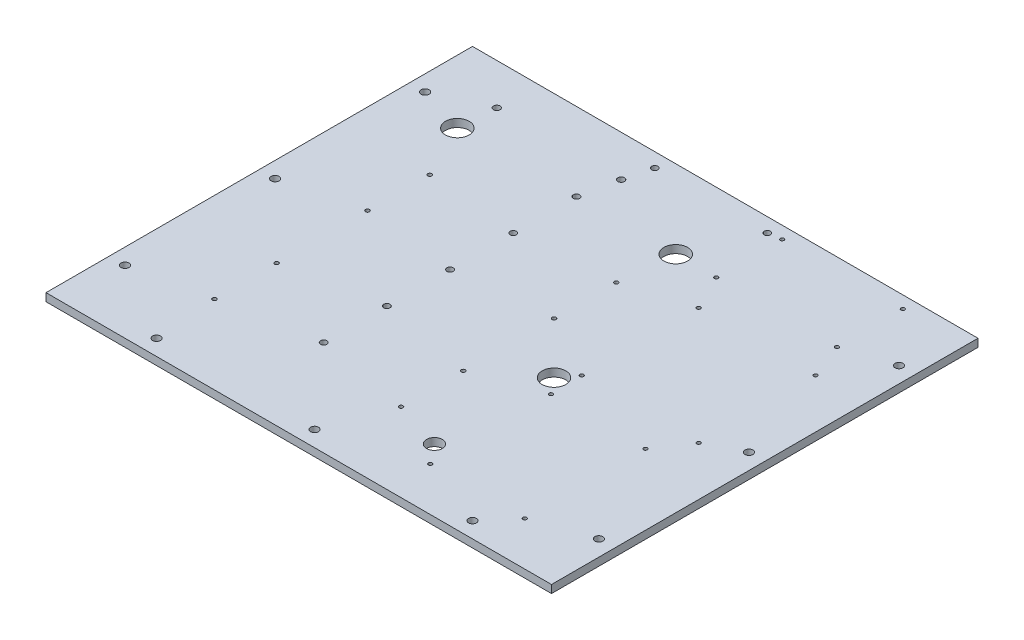
from build123d import *

# Parameters (mm, degrees)
SKETCH1_W           = 406.4
SKETCH1_H           = 342.9
BOSS_EXTRUDE1_DEPTH = 6.35
SKETCH3_R           = 3.175
CUT_EXTRUDE1_DEPTH  = 532.772218624
SKETCH4_R           = 9.525
SKETCH4_R_2         = 1.5875
SKETCH4_R_3         = 2.5
SKETCH4_R_4         = 2.667
SKETCH4_R_5         = 2.54
SKETCH4_R_6         = 1.5
SKETCH4_R_7         = 6.35
CUT_EXTRUDE2_DEPTH  = 532.772218624


with BuildPart() as part:
    # Sketch1 → Boss-Extrude1 (new body)
    with BuildSketch(Plane(origin=(0, 0, 0), x_dir=(1, 0, 0), z_dir=(0, 1, 0))):
        with Locations((203.2, 171.45)):
            Rectangle(SKETCH1_W, SKETCH1_H)
    extrude(amount=BOSS_EXTRUDE1_DEPTH)

    # Sketch3 → Cut-Extrude1 (cut, through all)
    with BuildSketch(Plane(origin=(0, 6.35, 0), x_dir=(1, 0, 0), z_dir=(0, 1, 0))):
        with Locations((203.2, 12.7)):
            Circle(SKETCH3_R)
        with Locations((330.2, 12.7)):
            Circle(SKETCH3_R)
        with Locations((76.2, 12.7)):
            Circle(SKETCH3_R)
        with Locations((12.7, 171.45)):
            Circle(SKETCH3_R)
        with Locations((393.7, 171.45)):
            Circle(SKETCH3_R)
        with Locations((12.7, 292.1)):
            Circle(SKETCH3_R)
        with Locations((12.7, 50.8)):
            Circle(SKETCH3_R)
        with Locations((393.7, 50.8)):
            Circle(SKETCH3_R)
        with Locations((393.7, 292.1)):
            Circle(SKETCH3_R)
    extrude(amount=-CUT_EXTRUDE1_DEPTH, mode=Mode.SUBTRACT)

    # Sketch4 → Cut-Extrude2 (cut, through all)
    with BuildSketch(Plane(origin=(0, 6.35, 0), x_dir=(1, 0, 0), z_dir=(0, 1, 0))):
        with Locations((226.4, 279.9)):
            Circle(SKETCH4_R)
        with Locations((50.8, 279.9)):
            Circle(SKETCH4_R)
        with Locations((222.1748, 63.265)):
            Circle(SKETCH4_R_2)
        with Locations((222.1748, 113.265)):
            Circle(SKETCH4_R_2)
        with Locations((72.1748, 113.265)):
            Circle(SKETCH4_R_2)
        with Locations((72.1748, 63.265)):
            Circle(SKETCH4_R_2)
        with Locations((72.1748, 186.295)):
            Circle(SKETCH4_R_2)
        with Locations((72.1748, 236.295)):
            Circle(SKETCH4_R_2)
        with Locations((222.1748, 236.295)):
            Circle(SKETCH4_R_2)
        with Locations((222.1748, 186.295)):
            Circle(SKETCH4_R_2)
        with Locations((248.4501, 331.47)):
            Circle(SKETCH4_R_3)
        with Locations((157.9499, 331.47)):
            Circle(SKETCH4_R_3)
        with Locations((52.5398, 309.88)):
            Circle(SKETCH4_R_4)
        with Locations((152.5398, 309.88)):
            Circle(SKETCH4_R_4)
        with Locations((146.3548, 178.4985)):
            Circle(SKETCH4_R_5)
        with Locations((146.3548, 127.6985)):
            Circle(SKETCH4_R_5)
        with Locations((146.3548, 76.8985)):
            Circle(SKETCH4_R_5)
        with Locations((146.3548, 280.0985)):
            Circle(SKETCH4_R_5)
        with Locations((146.3548, 229.2985)):
            Circle(SKETCH4_R_5)
        with Locations((355.833, 333.05)):
            Circle(SKETCH4_R_6)
        with Locations((258.833, 333.05)):
            Circle(SKETCH4_R_6)
        with Locations((355.833, 280.05)):
            Circle(SKETCH4_R_6)
        with Locations((258.833, 280.05)):
            Circle(SKETCH4_R_6)
        with Locations((366.9502, 251.78)):
            Circle(SKETCH4_R_6)
        with Locations((272.9502, 251.78)):
            Circle(SKETCH4_R_6)
        with Locations((366.9502, 157.78)):
            Circle(SKETCH4_R_6)
        with Locations((272.9502, 157.78)):
            Circle(SKETCH4_R_6)
        with Locations((349.7002, 35.25)):
            Circle(SKETCH4_R_6)
        with Locations((349.7002, 132.25)):
            Circle(SKETCH4_R_6)
        with Locations((273.7002, 132.25)):
            Circle(SKETCH4_R_6)
        with Locations((273.7002, 35.25)):
            Circle(SKETCH4_R_6)
        with Locations((263.4, 145)):
            Circle(SKETCH4_R)
        with Locations((261.4925, 50.8)):
            Circle(SKETCH4_R_7)
    extrude(amount=-CUT_EXTRUDE2_DEPTH, mode=Mode.SUBTRACT)


solid = part.part
